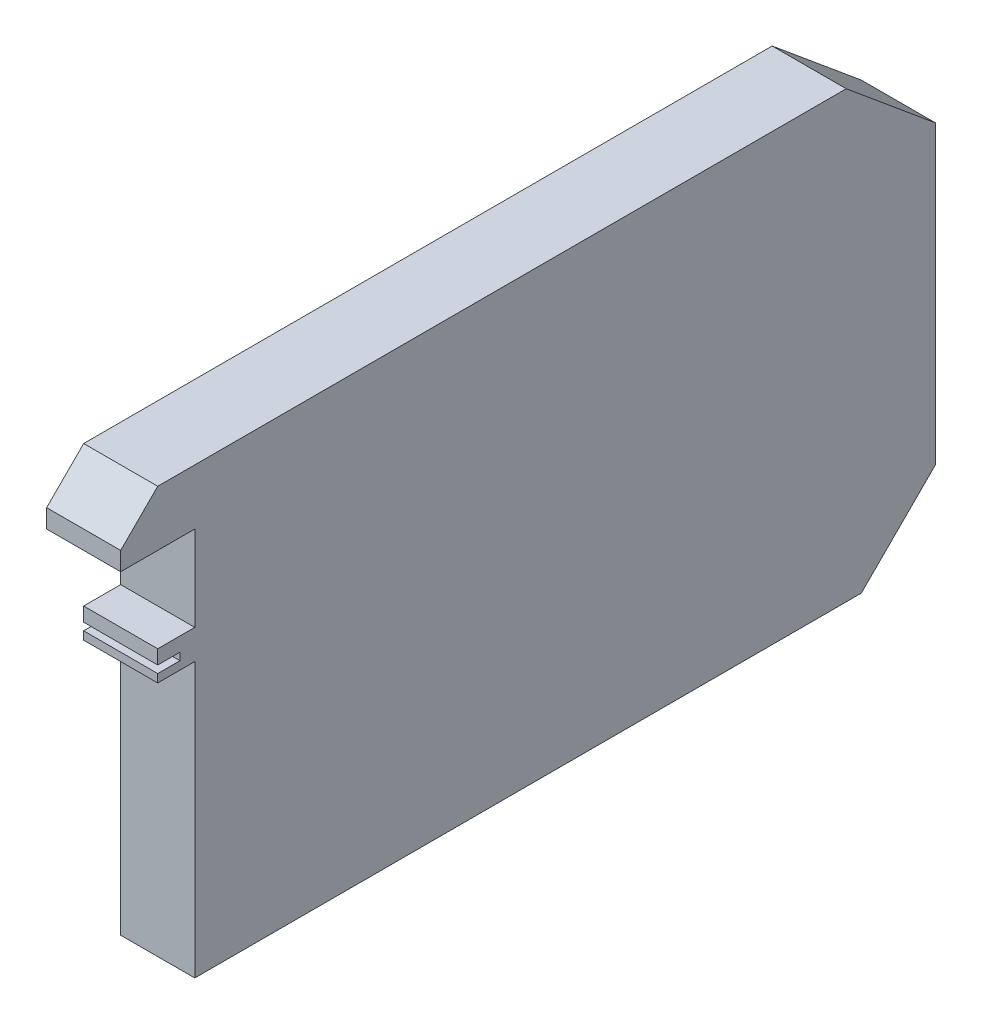
from build123d import *

# Parameters (mm, degrees)
BOSS_EXTRUDE1_DEPTH = 10
SKETCH2_W           = 10
SKETCH2_H           = 4
BOSS_EXTRUDE2_DEPTH = 5
SKETCH3_W           = 10
SKETCH3_H           = 7.5
BOSS_EXTRUDE3_DEPTH = 10
CHAMFER1_SIZE       = 5
SKETCH4_W           = 3
SKETCH4_H           = 1
CUT_EXTRUDE1_DEPTH  = 10


with BuildPart() as part:
    # Sketch1 → Boss-Extrude1 (new body)
    with BuildSketch(Plane(origin=(0, 0, 0), x_dir=(0, 0, -1), z_dir=(1, 0, 0))):
        Polygon((-22.923508233, 18.622830226), (-22.923508233, -36.377169774), (67.076491767, -36.377169774), (77.076491767, -26.377169774), (77.076491767, 13.622830226), (65.041232226, 23.622830226), (-14.958767774, 23.622830226), align=None)
    extrude(amount=-BOSS_EXTRUDE1_DEPTH)

    # Sketch2 → Boss-Extrude2 (add)
    with BuildSketch(Plane.XY.offset(22.923508233)):
        with Locations((-5, 2.622830226)):
            Rectangle(SKETCH2_W, SKETCH2_H)
    extrude(amount=BOSS_EXTRUDE2_DEPTH)

    # Sketch3 → Boss-Extrude3 (add, symmetric)
    with BuildSketch(Plane.XY.offset(22.923508233)):
        with Locations((-5, 19.872830226)):
            Rectangle(SKETCH3_W, SKETCH3_H)
    extrude(amount=BOSS_EXTRUDE3_DEPTH, both=True)

    # Chamfer1
    chamfer1_edges = [part.edges().sort_by_distance(p)[0] for p in [
        (-5, 23.622830226, 32.923508233),
    ]]
    chamfer(chamfer1_edges, length=CHAMFER1_SIZE)

    # Sketch4 → Cut-Extrude1 (cut)
    with BuildSketch(Plane(origin=(0, 0, 0), x_dir=(0, 0, -1), z_dir=(1, 0, 0))):
        with Locations((-26.423508233, 2.222830226)):
            Rectangle(SKETCH4_W, SKETCH4_H)
    extrude(amount=-CUT_EXTRUDE1_DEPTH, mode=Mode.SUBTRACT)


solid = part.part
